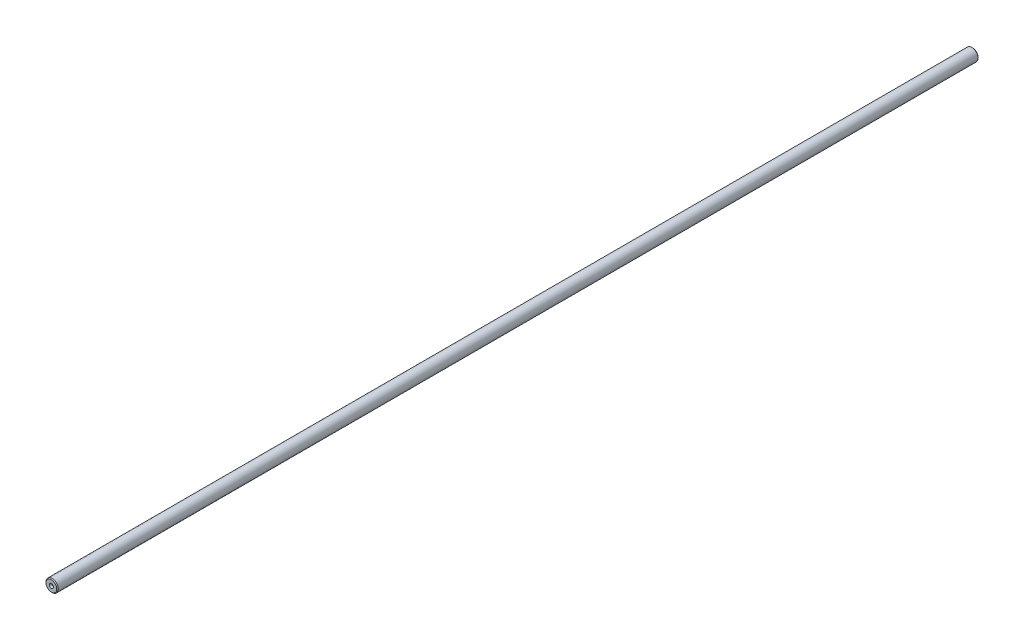
from build123d import *

# Parameters (mm, degrees)
SKETCH1_R           = 8
BOSS_EXTRUDE1_DEPTH = 600
CHAMFER1_SIZE       = 1


with BuildPart() as part:
    # Sketch1 → Boss-Extrude1 (new, symmetric)
    with BuildSketch(Plane.XY):
        Circle(SKETCH1_R)
    extrude(amount=BOSS_EXTRUDE1_DEPTH, both=True)

    # Sketch4 → CSK for M2.5 Flat Head Machine Screw1 (revolve, cut)
    with BuildSketch(Plane(origin=(0, 0, -600), x_dir=(0, 1, 0), z_dir=(1, 0, 0))):
        Polygon((0, 0), (0, 5), (1.45, 4.128752102), (1.45, 2.25166605), (2.75, 0), align=None)
    csk_for_m2_5_flat_head_machine_screw1 = revolve(axis=Axis((0, 0, -606.35), (0, 0, 1)), mode=Mode.SUBTRACT)

    # Mirror1: CSK for M2.5 Flat Head Machine Screw1 across plane
    add(csk_for_m2_5_flat_head_machine_screw1.mirror(Plane.XY), mode=Mode.SUBTRACT)

    # Chamfer1
    chamfer1_edges = [part.edges().sort_by_distance(p)[0] for p in [
        (-8, 0, -600),
        (-8, 0, 600),
    ]]
    chamfer(chamfer1_edges, length=CHAMFER1_SIZE)


solid = part.part
